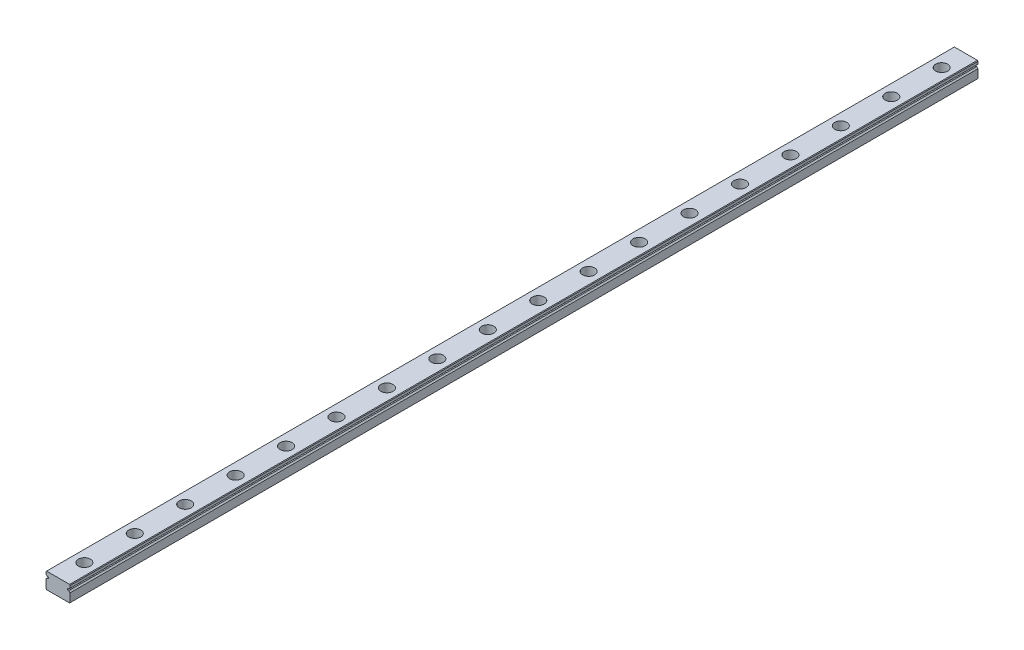
from build123d import *

# Parameters (mm, degrees)
EXTRUDE_1_DEPTH        = 450
SKETCH_2_R             = 3
SKETCH_2_R_2           = 1.75
CUT_EXTRUDE_1_DEPTH    = 4.5
SKETCH_2_2_R           = 1.75
CUT_EXTRUDE_2_DEPTH    = 451.111097397
PATTERN_LINEAR_1_COUNT = 24
PATTERN_LINEAR_1_PITCH = 25


with BuildPart() as part:
    # Эскиз1 → Бобышка-Вытянуть1 (new body)
    with BuildSketch(Plane.XY):
        with BuildLine():
            Line((-6, 3.7), (-5.7, 4))
            Line((-5.7, 4), (5.7, 4))
            Line((5.7, 4), (6, 3.7))
            Line((6, 3.7), (6, 2.451013544))
            ThreePointArc((6, 2.451013544), (5.597935912, 2.202976267), (5.354599002, 1.798050138))
            Line((5.354599002, 1.798050138), (4.643514056, 1.798050138))
            Line((4.643514056, 1.798050138), (4.643514056, 1.201949862))
            Line((4.643514056, 1.201949862), (5.354599002, 1.201949862))
            ThreePointArc((5.354599002, 1.201949862), (5.597935912, 0.797023733), (6, 0.548986456))
            Line((6, 0.548986456), (6, -3.7))
            Line((6, -3.7), (5.7, -4))
            Line((5.7, -4), (-5.7, -4))
            Line((-5.7, -4), (-6, -3.7))
            Line((-6, -3.7), (-6, 0.548986456))
            ThreePointArc((-6, 0.548986456), (-5.597935912, 0.797023733), (-5.354599002, 1.201949862))
            Line((-5.354599002, 1.201949862), (-4.643514056, 1.201949862))
            Line((-4.643514056, 1.201949862), (-4.643514056, 1.798050138))
            Line((-4.643514056, 1.798050138), (-5.354599002, 1.798050138))
            ThreePointArc((-5.354599002, 1.798050138), (-5.597935912, 2.202976267), (-6, 2.451013544))
            Line((-6, 2.451013544), (-6, 3.7))
        make_face()
    extrude(amount=EXTRUDE_1_DEPTH)

    # Эскиз2 → Вырез-Вытянуть1 (cut)
    with BuildSketch(Plane(origin=(0, 4, 0), x_dir=(1, 0, 0), z_dir=(0, 1, 0))):
        with Locations((0, -12)):
            Circle(SKETCH_2_R)
        with Locations((0, -12)):
            Circle(SKETCH_2_R_2, mode=Mode.SUBTRACT)
    cut_extrude_1 = extrude(amount=-CUT_EXTRUDE_1_DEPTH, mode=Mode.SUBTRACT)

    # Эскиз2<2> → Вырез-Вытянуть2 (cut, through all)
    with BuildSketch(Plane(origin=(0, 4, 0), x_dir=(1, 0, 0), z_dir=(0, 1, 0))):
        with Locations((0, -12)):
            Circle(SKETCH_2_2_R)
    cut_extrude_2 = extrude(amount=-CUT_EXTRUDE_2_DEPTH, mode=Mode.SUBTRACT)

    # Линейный массив1: Вырез-Вытянуть1, Вырез-Вытянуть2 ×24
    with Locations(*[(0, 0, i * PATTERN_LINEAR_1_PITCH) for i in range(1, PATTERN_LINEAR_1_COUNT)]):
        add(cut_extrude_1, mode=Mode.SUBTRACT)
        add(cut_extrude_2, mode=Mode.SUBTRACT)


solid = part.part
